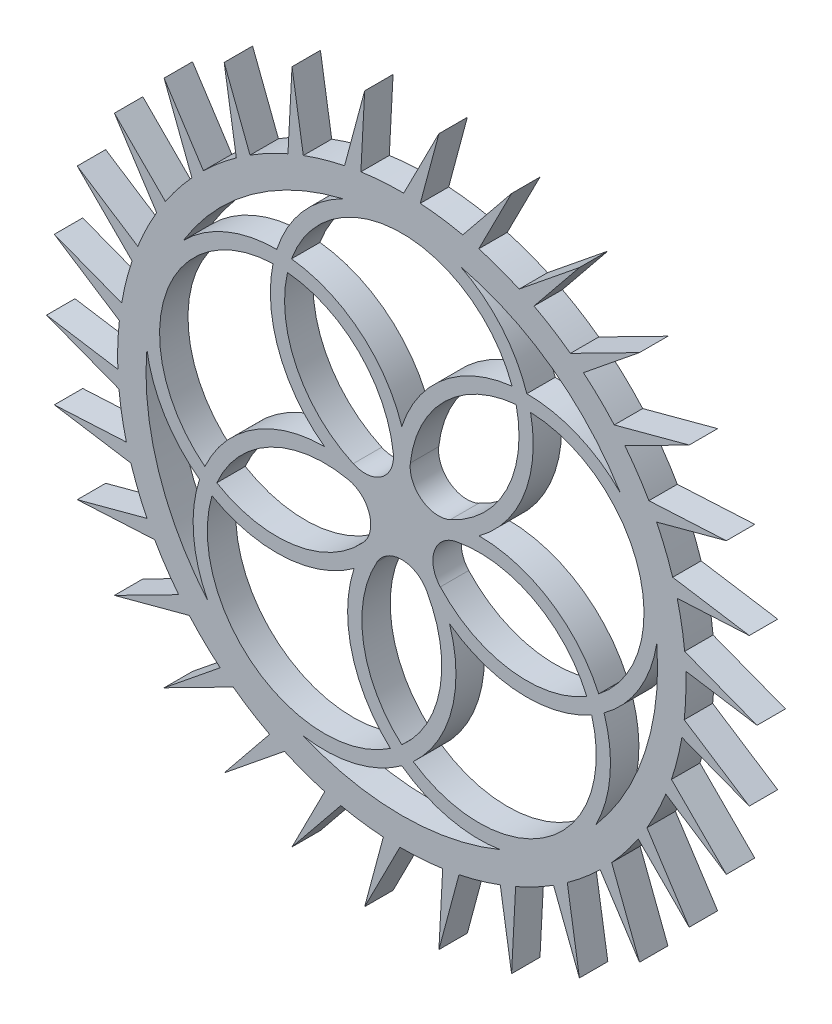
from build123d import *

# Parameters (mm, degrees)
SKETCH1_R           = 90
BOSS_EXTRUDE1_DEPTH = 10
CIRPATTERN1_COUNT   = 30
SKETCH2_R           = 46.25
SKETCH2_R_2         = 41.25
BOSS_EXTRUDE2_DEPTH = 10
CIRPATTERN3_COUNT   = 5
FILLET1_R           = 10


with BuildPart() as part:
    # Sketch1 → Boss-Extrude1 (new body)
    with BuildSketch(Plane.XY):
        with BuildLine():
            Line((99.921083111, 3.972046054), (125, 0))
            Line((125, 0), (99.52054525, 9.780647891))
            ThreePointArc((99.52054525, 9.780647891), (-99.763098111, -6.879262703), (99.921083111, 3.972046054))
        make_face()
        Circle(SKETCH1_R, mode=Mode.SUBTRACT)
    boss_extrude1 = extrude(amount=BOSS_EXTRUDE1_DEPTH)

    # CirPattern1: Boss-Extrude1 ×30 about axis
    cirpattern1_axis = Axis((0, 0, 10), (0, 0, -1))
    for i in range(1, CIRPATTERN1_COUNT):
        add(boss_extrude1.rotate(cirpattern1_axis, i * 360 / CIRPATTERN1_COUNT))

    # Sketch2 → Boss-Extrude2 (add)
    with BuildSketch(Plane.XY):
        with Locations((0, 46.25)):
            Circle(SKETCH2_R)
        with Locations((0, 46.25)):
            Circle(SKETCH2_R_2, mode=Mode.SUBTRACT)
    boss_extrude2 = extrude(amount=BOSS_EXTRUDE2_DEPTH)

    # CirPattern3: Boss-Extrude2 ×5 about axis
    cirpattern3_axis = Axis((0, 0, 10), (0, 0, -1))
    for i in range(1, CIRPATTERN3_COUNT):
        add(boss_extrude2.rotate(cirpattern3_axis, i * 360 / CIRPATTERN3_COUNT))

    # Fillet1
    fillet1_edges = [part.edges().sort_by_distance(p)[0] for p in [
        (3.757296457, 5.171474913, 5),
        (-3.757296457, 5.171474913, 5),
        (-6.079433373, -1.975327645, 5),
        (0, -6.392294536, 5),
        (6.079433373, -1.975327645, 5),
    ]]
    fillet(fillet1_edges, radius=FILLET1_R)


solid = part.part
